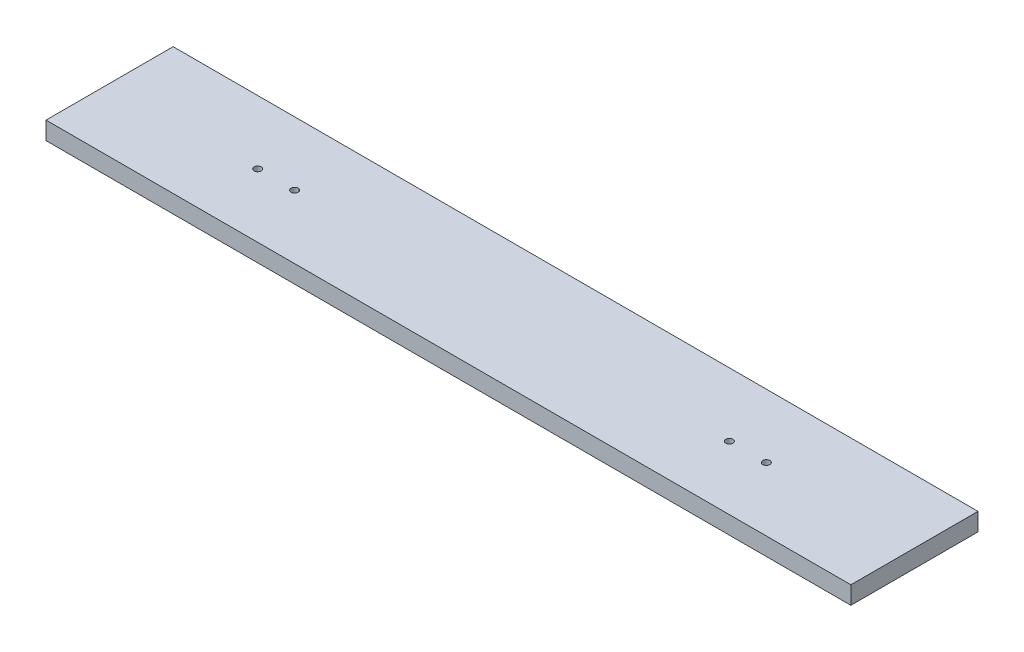
from build123d import *

# Parameters (mm, degrees)
SKETCH3_W           = 803.91
SKETCH3_H           = 17.78
BOSS_EXTRUDE1_DEPTH = 127
SKETCH4_R           = 3.556
CUT_EXTRUDE1_DEPTH  = 422.915809641
SKETCH5_R           = 3.556
CUT_EXTRUDE2_DEPTH  = 422.915809641


with BuildPart() as part:
    # Sketch3 → Boss-Extrude1 (new body)
    with BuildSketch(Plane.XY):
        Rectangle(SKETCH3_W, SKETCH3_H)
    extrude(amount=BOSS_EXTRUDE1_DEPTH)

    # Sketch4 → Cut-Extrude1 (cut, through all)
    with BuildSketch(Plane(origin=(0, 8.89, 0), x_dir=(1, 0, 0), z_dir=(0, 1, 0))):
        with Locations(Location((-254, -63.5, 0), (0, 0, 270))):
            Circle(SKETCH4_R)
        with Locations(Location((254, -63.5, 0), (0, 0, 270))):
            Circle(SKETCH4_R)
    extrude(amount=-CUT_EXTRUDE1_DEPTH, mode=Mode.SUBTRACT)

    # Sketch5 → Cut-Extrude2 (cut, through all)
    with BuildSketch(Plane.XZ.offset(8.89)):
        with Locations(Location((-217.17, 63.5, 0), (0, 0, 270))):
            Circle(SKETCH5_R)
        with Locations(Location((217.17, 63.5, 0), (0, 0, 270))):
            Circle(SKETCH5_R)
    extrude(amount=-CUT_EXTRUDE2_DEPTH, mode=Mode.SUBTRACT)


solid = part.part
